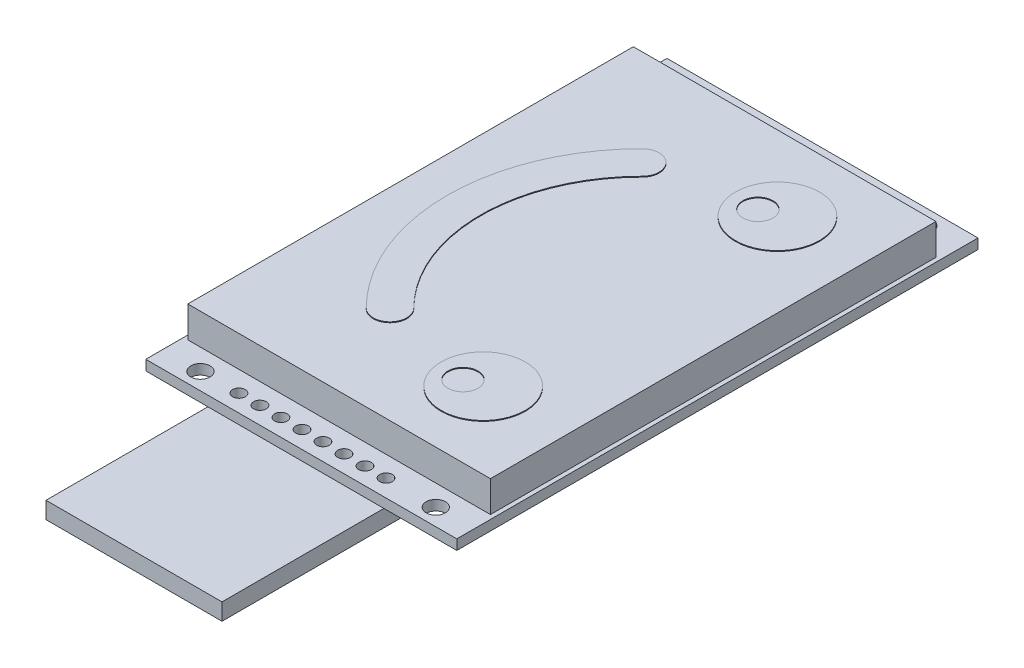
from build123d import *

# Parameters (mm, degrees)
SKETCH1_W           = 37
SKETCH1_H           = 62
SKETCH1_R           = 1.15
BOSS_EXTRUDE1_DEPTH = 1.2
SKETCH2_W           = 36
SKETCH2_H           = 53
BOSS_EXTRUDE2_DEPTH = 3.7
SKETCH3_R           = 0.75
CUT_EXTRUDE1_DEPTH  = 73.295850503
SKETCH4_R           = 5
SKETCH4_R_2         = 1.786053174
BOSS_EXTRUDE3_DEPTH = 0.1
SKETCH5_W           = 20.937122204
SKETCH5_H           = 23.749430493
BOSS_EXTRUDE4_DEPTH = 2


with BuildPart() as part:
    # Sketch1 → Boss-Extrude1 (new body)
    with BuildSketch(Plane(origin=(0, 0, 0), x_dir=(1, 0, 0), z_dir=(0, 1, 0))):
        with Locations((18.5, 31)):
            Rectangle(SKETCH1_W, SKETCH1_H)
        with Locations(Location((32.5, 60, 0), (0, 0, 270))):
            Circle(SKETCH1_R, mode=Mode.SUBTRACT)
        with Locations(Location((4.5, 60, 0), (0, 0, 270))):
            Circle(SKETCH1_R, mode=Mode.SUBTRACT)
        with Locations(Location((32.5, 2, 0), (0, 0, 270))):
            Circle(SKETCH1_R, mode=Mode.SUBTRACT)
        with Locations(Location((4.5, 2, 0), (0, 0, 270))):
            Circle(SKETCH1_R, mode=Mode.SUBTRACT)
    extrude(amount=BOSS_EXTRUDE1_DEPTH)

    # Sketch2 → Boss-Extrude2 (add)
    with BuildSketch(Plane(origin=(0, 1.2, 0), x_dir=(1, 0, 0), z_dir=(0, 1, 0))):
        with Locations((18.5, 31)):
            Rectangle(SKETCH2_W, SKETCH2_H)
    extrude(amount=BOSS_EXTRUDE2_DEPTH)

    # Sketch3 → Cut-Extrude1 (cut, through all)
    with BuildSketch(Plane(origin=(0, 1.2, 0), x_dir=(1, 0, 0), z_dir=(0, 1, 0))):
        with Locations(Location((9.031578358, 2.050688375, 0), (0, 0, 270))):
            Circle(SKETCH3_R)
        with Locations(Location((11.531578358, 2.050688375, 0), (0, 0, 270))):
            Circle(SKETCH3_R)
        with Locations(Location((14.031578358, 2.050688375, 0), (0, 0, 270))):
            Circle(SKETCH3_R)
        with Locations(Location((16.531578358, 2.050688375, 0), (0, 0, 270))):
            Circle(SKETCH3_R)
        with Locations(Location((19.031578358, 2.050688375, 0), (0, 0, 270))):
            Circle(SKETCH3_R)
        with Locations(Location((21.531578358, 2.050688375, 0), (0, 0, 270))):
            Circle(SKETCH3_R)
        with Locations(Location((24.031578358, 2.050688375, 0), (0, 0, 270))):
            Circle(SKETCH3_R)
        with Locations(Location((26.531578358, 2.050688375, 0), (0, 0, 270))):
            Circle(SKETCH3_R)
    extrude(amount=-CUT_EXTRUDE1_DEPTH, mode=Mode.SUBTRACT)

    # Sketch4 → Boss-Extrude3 (add)
    # profile 1 of 3: a face of its own
    with BuildSketch(Plane(origin=(0, 4.9, 0), x_dir=(1, 0, 0), z_dir=(0, 1, 0))):
        with Locations(Location((26.639884222, 48.5, 0), (0, 0, 270))):
            Circle(SKETCH4_R)
        with Locations(Location((24.763300075, 48.058155317, 0), (0, 0, 270))):
            Circle(SKETCH4_R_2, mode=Mode.SUBTRACT)
    # profile 2 of 3: a face of its own
    with BuildSketch(Plane(origin=(0, 4.9, 0), x_dir=(1, 0, 0), z_dir=(0, 1, 0))):
        with Locations(Location((26.639884222, 13.5, 0), (0, 0, 270))):
            Circle(SKETCH4_R)
        with Locations(Location((24.763300075, 12.971685579, 0), (0, 0, 270))):
            Circle(SKETCH4_R_2, mode=Mode.SUBTRACT)
    # profile 3 of 3: a face of its own
    with BuildSketch(Plane(origin=(0, 4.9, 0), x_dir=(1, 0, 0), z_dir=(0, 1, 0))):
        with BuildLine():
            ThreePointArc((11.640146641, 47.414213562), (4.841156768, 31), (11.640146641, 14.585786438))
            ThreePointArc((11.640146641, 14.585786438), (14.468573766, 14.585786438), (14.468573766, 17.414213562))
            ThreePointArc((14.468573766, 17.414213562), (8.841156768, 31), (14.468573766, 44.585786438))
            ThreePointArc((14.468573766, 44.585786438), (14.468573766, 47.414213562), (11.640146641, 47.414213562))
        make_face()
    extrude(amount=BOSS_EXTRUDE3_DEPTH)

    # Sketch5 → Boss-Extrude4 (add)
    with BuildSketch(Plane.XZ):
        with Locations((17.860565838, 7.383650804)):
            Rectangle(SKETCH5_W, SKETCH5_H)
    extrude(amount=BOSS_EXTRUDE4_DEPTH)


solid = part.part
